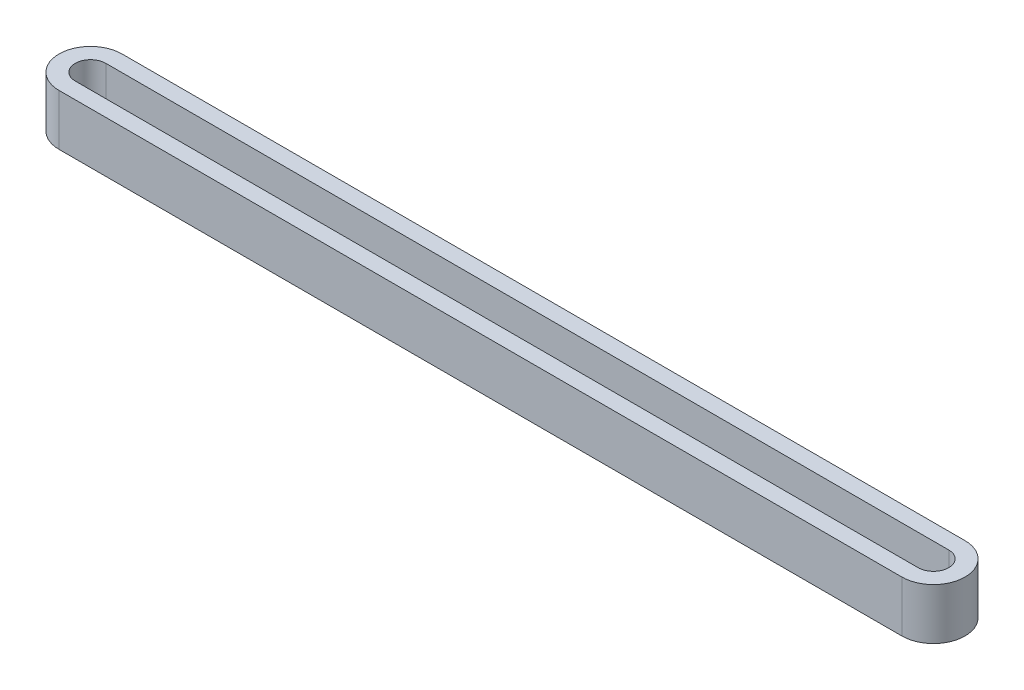
from build123d import *

# Parameters (mm, degrees)
BOSS_EXTRUDE1_DEPTH = 10


with BuildPart() as part:
    # Sketch1 → Boss-Extrude1 (new body)
    with BuildSketch(Plane(origin=(0, 0, 0), x_dir=(1, 0, 0), z_dir=(0, 1, 0))):
        with BuildLine():
            Line((82.5, -6.175), (-82.5, -6.175))
            ThreePointArc((-82.5, -6.175), (-88.675, 0), (-82.5, 6.175))
            Line((-82.5, 6.175), (82.5, 6.175))
            ThreePointArc((82.5, 6.175), (88.675, 0), (82.5, -6.175))
        make_face()
        with BuildLine():
            Line((82.5, -3), (-82.5, -3))
            ThreePointArc((-82.5, -3), (-85.5, 0), (-82.5, 3))
            Line((-82.5, 3), (82.5, 3))
            ThreePointArc((82.5, 3), (85.5, 0), (82.5, -3))
        make_face(mode=Mode.SUBTRACT)
    extrude(amount=BOSS_EXTRUDE1_DEPTH)


solid = part.part
